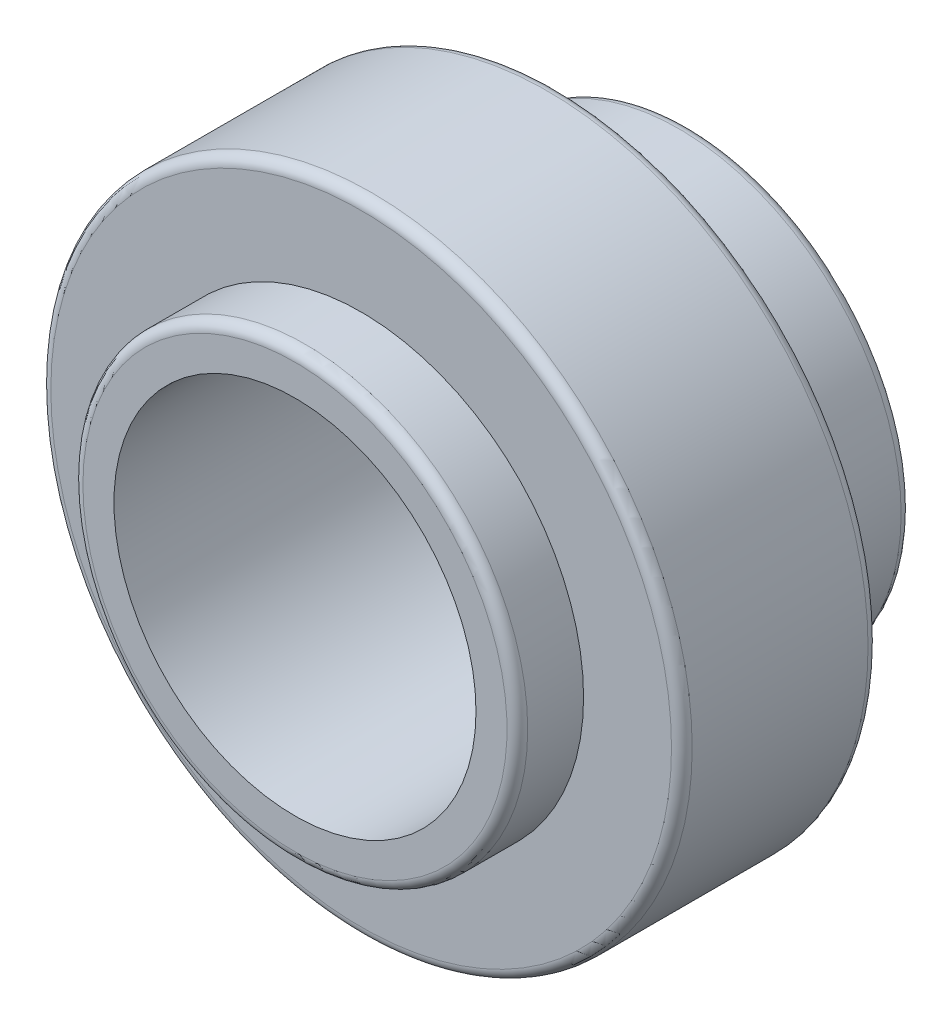
from build123d import *

# Parameters (mm, degrees)
ZAOKR_GLENIE1_R = 1


with BuildPart() as part:
    # Szkic2 → Obrót1 (revolve)
    with BuildSketch(Plane(origin=(0, 0, 0), x_dir=(0, 0, -1), z_dir=(1, 0, 0)), mode=Mode.PRIVATE) as obr_t1_sk:
        Polygon((-9.5, 21.5), (-9.5, 31), (9.5, 31), (9.5, 21.5), (22.2, 21.5), (22.2, 17.5), (-15.9, 17.5), (-15.9, 21.5), align=None)
    revolve(obr_t1_sk.sketch.rotate(Axis((0, 0, 23.470588235), (0, 0, -1)), 90), axis=Axis((0, 0, 23.470588235), (0, 0, -1)))

    # Zaokrąglenie1
    zaokr_glenie1_edges = [part.edges().sort_by_distance(p)[0] for p in [
        (-21.5, 0, 15.9),
        (-31, 0, 9.5),
        (-31, 0, -9.5),
        (-21.5, 0, -22.2),
    ]]
    fillet(zaokr_glenie1_edges, radius=ZAOKR_GLENIE1_R)


solid = part.part
